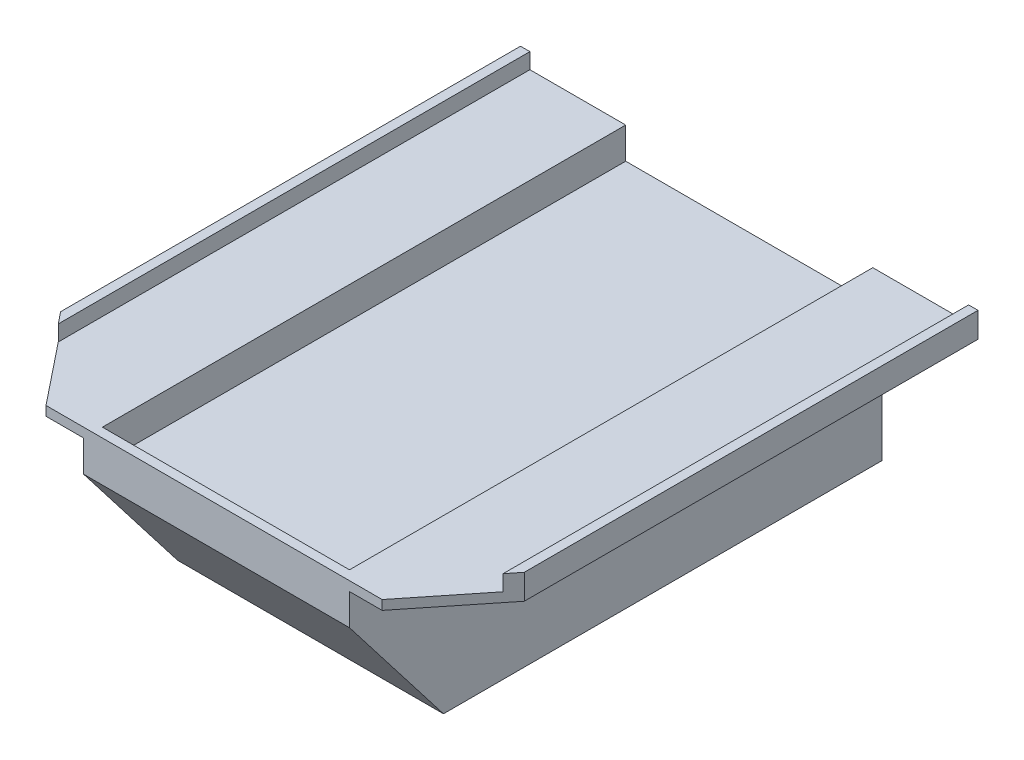
from build123d import *

# Parameters (mm, degrees)
Y_KSEKLIK_EKSTR_ZYON2_DEPTH = 170
KES_EKSTR_ZYON1_DEPTH       = 190.035552212
KES_EKSTR_ZYON1_DEPTH_BACK  = 190.035552212
IZIM3_W                     = 78.85
IZIM3_H                     = 49.045285197
Y_KSEKLIK_EKSTR_ZYON3_DEPTH = 3
KES_EKSTR_ZYON3_DEPTH       = 190.035552212
KES_EKSTR_ZYON3_DEPTH_BACK  = 190.035552212
IZIM5_W                     = 84.85
IZIM5_H                     = 13
Y_KSEKLIK_EKSTR_ZYON4_DEPTH = 3


with BuildPart() as part:
    # Çizim1 → Yükseklik-Ekstrüzyon2 (new body)
    with BuildSketch(Plane.XY):
        Polygon((-39.425, 0), (39.425, 0), (39.425, -38.8), (42.425, -38.8), (42.425, 10), (73, 10), (73, 18), (70, 18), (70, 13), (39.425, 13), (39.425, 3), (-39.425, 3), (-39.425, 13), (-70, 13), (-70, 18), (-73, 18), (-73, 10), (-42.425, 10), (-42.425, -38.8), (-39.425, -38.8), align=None)
    extrude(amount=Y_KSEKLIK_EKSTR_ZYON2_DEPTH)

    # Çizim2 → Kes-Ekstrüzyon1 (cut, two sides: drawn at the far end of the back side and taken through both)
    with BuildSketch(Plane(origin=(0, 0, 0), x_dir=(0, 0, -1), z_dir=(1, 0, 0)).offset(-KES_EKSTR_ZYON1_DEPTH_BACK)):
        Polygon((-170, -38.8), (-170, 0), (-140, -38.8), align=None)
    extrude(amount=KES_EKSTR_ZYON1_DEPTH + KES_EKSTR_ZYON1_DEPTH_BACK, mode=Mode.SUBTRACT)

    # Çizim3 → Yükseklik-Ekstrüzyon3 (add)
    with BuildSketch(Plane(origin=(0, -82.263535985, 106.394173207), x_dir=(1, 0, 0), z_dir=(0, -0.6116795912153945, 0.7911056046385767))):
        with Locations((0, 79.462887909)):
            Rectangle(IZIM3_W, IZIM3_H)
    extrude(amount=-Y_KSEKLIK_EKSTR_ZYON3_DEPTH)

    # Çizim4 → Kes-Ekstrüzyon3 (cut, two sides: drawn at the far end of the back side and taken through both)
    with BuildSketch(Plane(origin=(0, 0, 0), x_dir=(1, 0, 0), z_dir=(0, 1, 0)).offset(-KES_EKSTR_ZYON3_DEPTH_BACK)):
        Polygon((-73, -170), (-73, -146.754135669), (-54.421757633, -170), align=None)
        Polygon((52.86, -170), (73, -170), (73, -144.8), align=None)
    extrude(amount=KES_EKSTR_ZYON3_DEPTH + KES_EKSTR_ZYON3_DEPTH_BACK, mode=Mode.SUBTRACT)

    # Çizim5 → Yükseklik-Ekstrüzyon4 (add)
    with BuildSketch(Plane.XY.offset(170)):
        with Locations((0, 6.5)):
            Rectangle(IZIM5_W, IZIM5_H)
    extrude(amount=-Y_KSEKLIK_EKSTR_ZYON4_DEPTH)


solid = part.part
